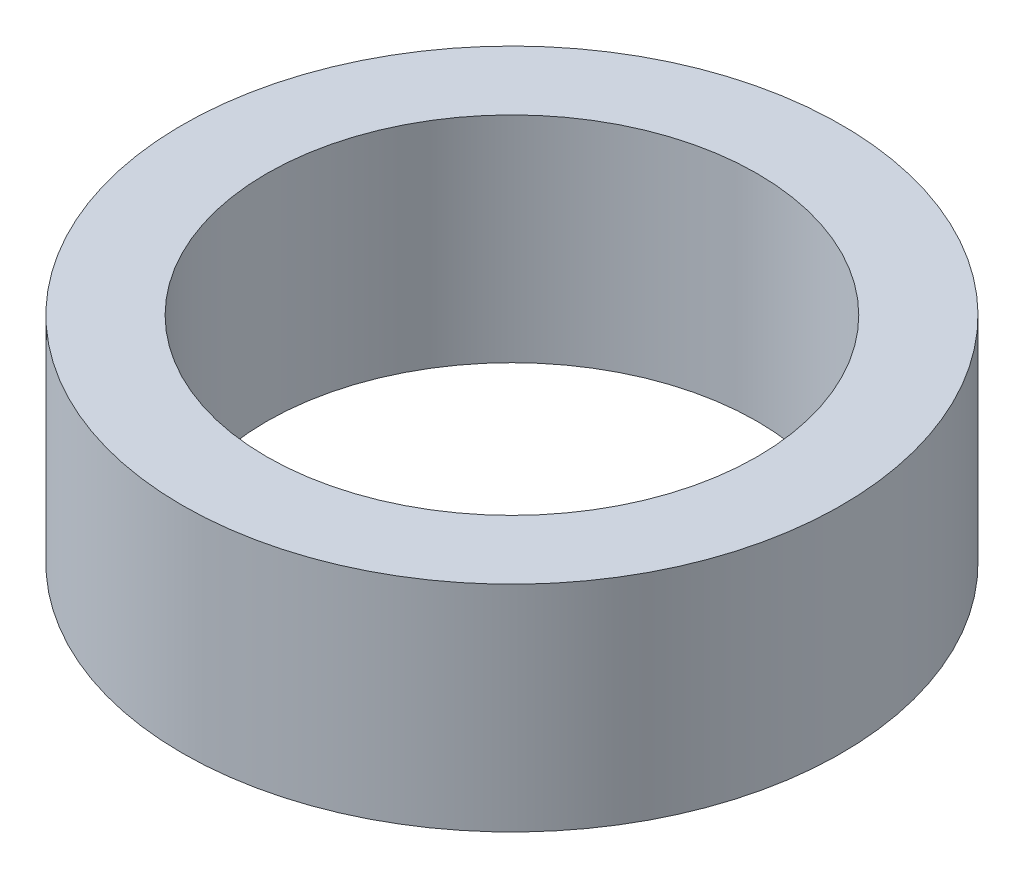
from build123d import *

# Parameters (mm, degrees)
SKETCH1_R           = 21.5
SKETCH1_R_2         = 16
BOSS_EXTRUDE1_DEPTH = 14


with BuildPart() as part:
    # Sketch1 → Boss-Extrude1 (new body)
    with BuildSketch(Plane(origin=(0, 0, 0), x_dir=(1, 0, 0), z_dir=(0, 1, 0))):
        with Locations(Location((0, 0, 0), (0, 0, 270))):
            Circle(SKETCH1_R)
        with Locations(Location((0, 0, 0), (0, 0, 270))):
            Circle(SKETCH1_R_2, mode=Mode.SUBTRACT)
    extrude(amount=BOSS_EXTRUDE1_DEPTH)


solid = part.part
